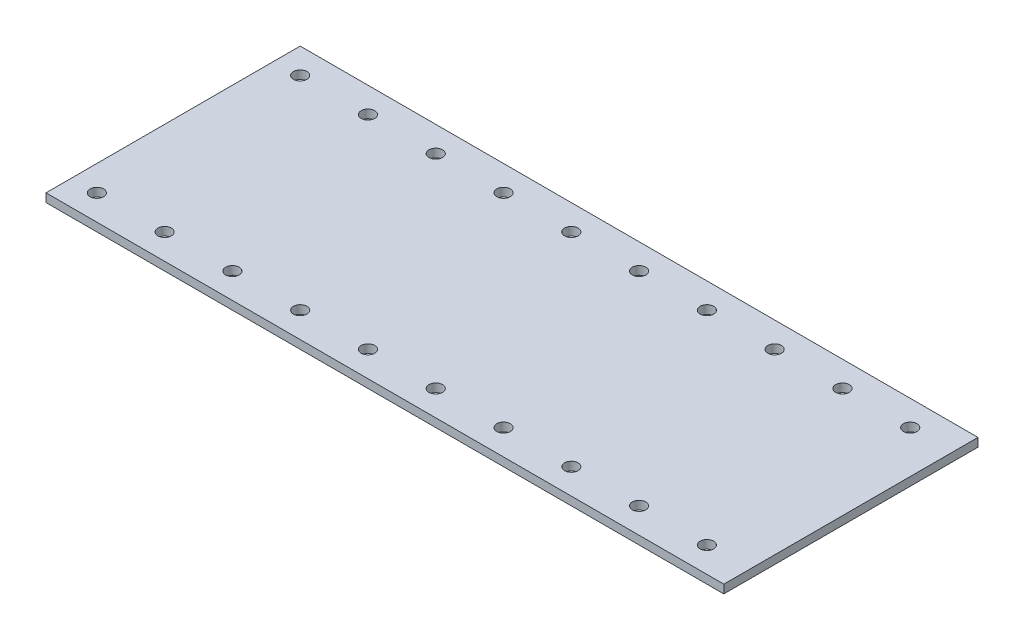
from build123d import *

# Parameters (mm, degrees)
SKETCH1_W                      = 200
SKETCH1_H                      = 75
BOSS_EXTRUDE1_DEPTH            = 2.5
F_4_0MM_DOWEL_HOLE1_AT_2_COUNT = 2
F_4_0MM_DOWEL_HOLE1_AT_2_PITCH = 60
LPATTERN1_COUNT                = 10
LPATTERN1_PITCH                = 20


with BuildPart() as part:
    # Sketch1 → Boss-Extrude1 (new body)
    with BuildSketch(Plane(origin=(0, 0, 0), x_dir=(1, 0, 0), z_dir=(0, 1, 0))):
        Rectangle(SKETCH1_W, SKETCH1_H)
    extrude(amount=BOSS_EXTRUDE1_DEPTH)

    # Sketch4 → Ø4.0mm Dowel Hole1 (revolve, cut)
    with BuildSketch(Plane(origin=(-92.5, 2.5, -30), x_dir=(0, 0, 1), z_dir=(1, 0, 0))):
        Polygon((0, 0), (0, 2.5), (2.025, 2.5), (2, 2.475), (2, 0), align=None)
    f_4_0mm_dowel_hole1 = revolve(axis=Axis((-92.5, 8.85, -30), (0, -1, 0)), mode=Mode.SUBTRACT)

    # Ø4.0mm Dowel Hole1 at 2: Ø4.0mm Dowel Hole1 ×2
    with Locations(*[(0, 0, i * F_4_0MM_DOWEL_HOLE1_AT_2_PITCH) for i in range(1, F_4_0MM_DOWEL_HOLE1_AT_2_COUNT)]):
        add(f_4_0mm_dowel_hole1, mode=Mode.SUBTRACT)

    # LPattern1: Ø4.0mm Dowel Hole1 ×10
    with Locations(*[(i * LPATTERN1_PITCH, 0, 0) for i in range(1, LPATTERN1_COUNT)]):
        add(f_4_0mm_dowel_hole1, mode=Mode.SUBTRACT)

    # LPattern1 copy 1 sketch → LPattern1 copy 1 (revolve, cut)
    with BuildSketch(Plane(origin=(-72.5, 2.5, 30), x_dir=(0, 0, 1), z_dir=(1, 0, 0))):
        Polygon((0, 0), (0, 2.5), (2.025, 2.5), (2, 2.475), (2, 0), align=None)
    revolve(axis=Axis((-72.5, 8.85, 30), (0, -1, 0)), mode=Mode.SUBTRACT)

    # LPattern1 copy 2 sketch → LPattern1 copy 2 (revolve, cut)
    with BuildSketch(Plane(origin=(-52.5, 2.5, 30), x_dir=(0, 0, 1), z_dir=(1, 0, 0))):
        Polygon((0, 0), (0, 2.5), (2.025, 2.5), (2, 2.475), (2, 0), align=None)
    revolve(axis=Axis((-52.5, 8.85, 30), (0, -1, 0)), mode=Mode.SUBTRACT)

    # LPattern1 copy 3 sketch → LPattern1 copy 3 (revolve, cut)
    with BuildSketch(Plane(origin=(-32.5, 2.5, 30), x_dir=(0, 0, 1), z_dir=(1, 0, 0))):
        Polygon((0, 0), (0, 2.5), (2.025, 2.5), (2, 2.475), (2, 0), align=None)
    revolve(axis=Axis((-32.5, 8.85, 30), (0, -1, 0)), mode=Mode.SUBTRACT)

    # LPattern1 copy 4 sketch → LPattern1 copy 4 (revolve, cut)
    with BuildSketch(Plane(origin=(-12.5, 2.5, 30), x_dir=(0, 0, 1), z_dir=(1, 0, 0))):
        Polygon((0, 0), (0, 2.5), (2.025, 2.5), (2, 2.475), (2, 0), align=None)
    revolve(axis=Axis((-12.5, 8.85, 30), (0, -1, 0)), mode=Mode.SUBTRACT)

    # LPattern1 copy 5 sketch → LPattern1 copy 5 (revolve, cut)
    with BuildSketch(Plane(origin=(7.5, 2.5, 30), x_dir=(0, 0, 1), z_dir=(1, 0, 0))):
        Polygon((0, 0), (0, 2.5), (2.025, 2.5), (2, 2.475), (2, 0), align=None)
    revolve(axis=Axis((7.5, 8.85, 30), (0, -1, 0)), mode=Mode.SUBTRACT)

    # LPattern1 copy 6 sketch → LPattern1 copy 6 (revolve, cut)
    with BuildSketch(Plane(origin=(27.5, 2.5, 30), x_dir=(0, 0, 1), z_dir=(1, 0, 0))):
        Polygon((0, 0), (0, 2.5), (2.025, 2.5), (2, 2.475), (2, 0), align=None)
    revolve(axis=Axis((27.5, 8.85, 30), (0, -1, 0)), mode=Mode.SUBTRACT)

    # LPattern1 copy 7 sketch → LPattern1 copy 7 (revolve, cut)
    with BuildSketch(Plane(origin=(47.5, 2.5, 30), x_dir=(0, 0, 1), z_dir=(1, 0, 0))):
        Polygon((0, 0), (0, 2.5), (2.025, 2.5), (2, 2.475), (2, 0), align=None)
    revolve(axis=Axis((47.5, 8.85, 30), (0, -1, 0)), mode=Mode.SUBTRACT)

    # LPattern1 copy 8 sketch → LPattern1 copy 8 (revolve, cut)
    with BuildSketch(Plane(origin=(67.5, 2.5, 30), x_dir=(0, 0, 1), z_dir=(1, 0, 0))):
        Polygon((0, 0), (0, 2.5), (2.025, 2.5), (2, 2.475), (2, 0), align=None)
    revolve(axis=Axis((67.5, 8.85, 30), (0, -1, 0)), mode=Mode.SUBTRACT)

    # LPattern1 copy 9 sketch → LPattern1 copy 9 (revolve, cut)
    with BuildSketch(Plane(origin=(87.5, 2.5, 30), x_dir=(0, 0, 1), z_dir=(1, 0, 0))):
        Polygon((0, 0), (0, 2.5), (2.025, 2.5), (2, 2.475), (2, 0), align=None)
    revolve(axis=Axis((87.5, 8.85, 30), (0, -1, 0)), mode=Mode.SUBTRACT)


solid = part.part
